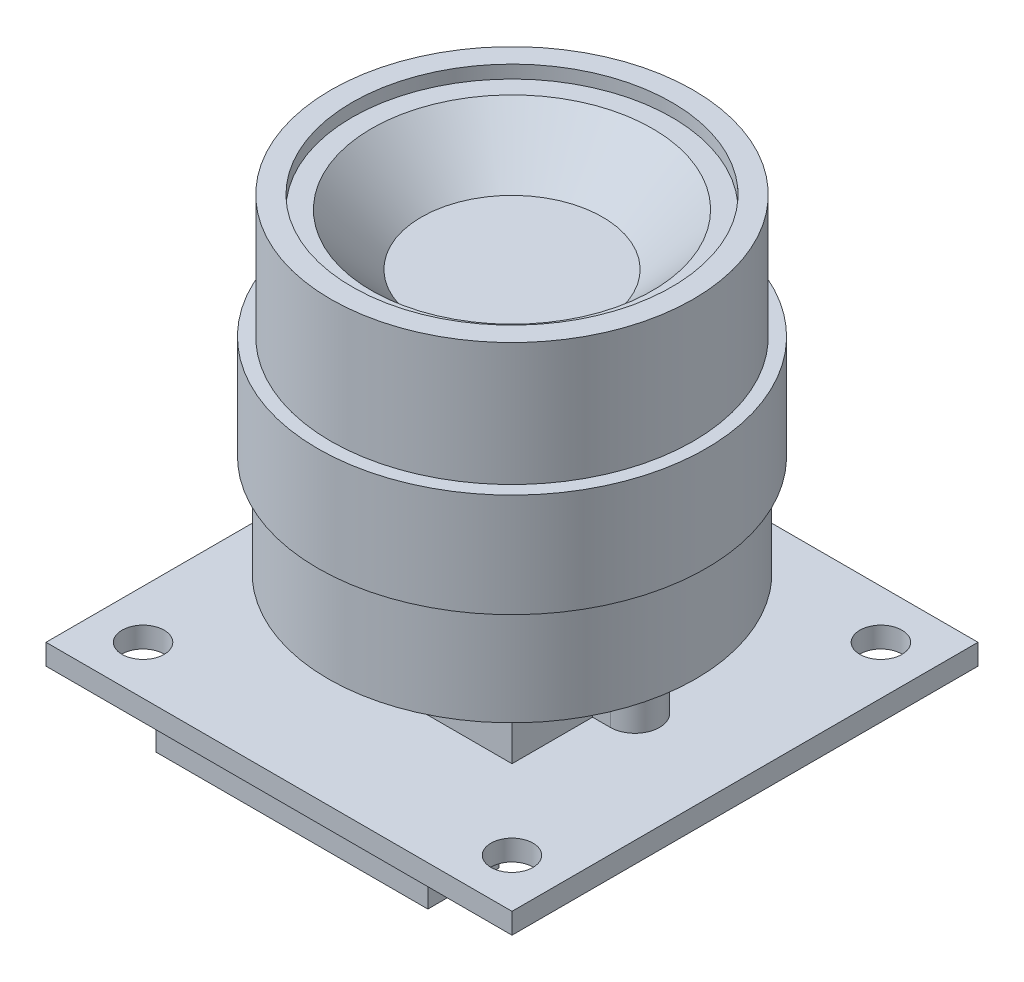
from build123d import *

# Parameters (mm, degrees)
SKETCH1_W                  = 36
SKETCH1_H                  = 36
BOSS_EXTRUDE1_DEPTH        = 1.6
F_3_2_3_2_DIAMETER_HOLE1_D = 3.25
BOSS_EXTRUDE2_DEPTH        = 4.65
SKETCH5_R                  = 14.2
BOSS_EXTRUDE3_DEPTH        = 7.8
SKETCH6_R                  = 15
BOSS_EXTRUDE4_DEPTH        = 8
SKETCH7_R                  = 14
BOSS_EXTRUDE5_DEPTH        = 9.5
SKETCH8_W                  = 21
SKETCH8_H                  = 5.5
BOSS_EXTRUDE6_DEPTH        = 2.5


with BuildPart() as part:
    # Sketch1 → Boss-Extrude1 (new body)
    with BuildSketch(Plane(origin=(0, 0, 0), x_dir=(1, 0, 0), z_dir=(0, 1, 0))):
        Rectangle(SKETCH1_W, SKETCH1_H)
    extrude(amount=BOSS_EXTRUDE1_DEPTH)

    # Ø3.2 (3.2) Diameter Hole1 (through all)
    with Locations(Plane(origin=(0, 1.6, 0), x_dir=(1, 0, 0), z_dir=(0, 1, 0))):
        with Locations((-14.25, 14.25), (14.25, 14.25), (14.25, -14.25), (-14.25, -14.25)):
            Hole(F_3_2_3_2_DIAMETER_HOLE1_D / 2)

    # Sketch4 → Boss-Extrude2 (add)
    with BuildSketch(Plane(origin=(0, 1.6, 0), x_dir=(1, 0, 0), z_dir=(0, 1, 0))):
        with BuildLine():
            Line((-8.125, -8.125), (8.125, -8.125))
            Line((8.125, -8.125), (8.125, -1.9))
            Line((8.125, -1.9), (9.5, -1.9))
            ThreePointArc((9.5, -1.9), (11.4, 0), (9.5, 1.9))
            Line((9.5, 1.9), (8.125, 1.9))
            Line((8.125, 1.9), (8.125, 8.125))
            Line((8.125, 8.125), (-8.125, 8.125))
            Line((-8.125, 8.125), (-8.125, 1.9))
            Line((-8.125, 1.9), (-9.5, 1.9))
            ThreePointArc((-9.5, 1.9), (-11.4, 0), (-9.5, -1.9))
            Line((-9.5, -1.9), (-8.125, -1.9))
            Line((-8.125, -1.9), (-8.125, -8.125))
        make_face()
    extrude(amount=BOSS_EXTRUDE2_DEPTH)

    # Sketch5 → Boss-Extrude3 (add)
    with BuildSketch(Plane(origin=(0, 6.25, 0), x_dir=(1, 0, 0), z_dir=(0, 1, 0))):
        with Locations(Location((0, 0, 0), (0, 0, 270))):
            Circle(SKETCH5_R)
    extrude(amount=BOSS_EXTRUDE3_DEPTH)

    # Sketch6 → Boss-Extrude4 (add)
    with BuildSketch(Plane(origin=(0, 14.05, 0), x_dir=(1, 0, 0), z_dir=(0, 1, 0))):
        with Locations(Location((0, 0, 0), (0, 0, 270))):
            Circle(SKETCH6_R)
    extrude(amount=BOSS_EXTRUDE4_DEPTH)

    # Sketch7 → Boss-Extrude5 (add)
    with BuildSketch(Plane(origin=(0, 22.05, 0), x_dir=(1, 0, 0), z_dir=(0, 1, 0))):
        with Locations(Location((0, 0, 0), (0, 0, 270))):
            Circle(SKETCH7_R)
    extrude(amount=BOSS_EXTRUDE5_DEPTH)

    # Sketch8 → Boss-Extrude6 (add)
    with BuildSketch(Plane.XZ):
        with Locations((0, 14.25)):
            Rectangle(SKETCH8_W, SKETCH8_H)
    extrude(amount=BOSS_EXTRUDE6_DEPTH)

    # Sketch9 → Cut-Revolve1 (revolve, cut)
    with BuildSketch(Plane.XY, mode=Mode.PRIVATE) as cut_revolve1_sk:
        Polygon((0, 31.55), (0, 26.55), (7, 26.55), (10.85, 30.55), (12.35, 30.55), (12.35, 31.55), align=None)
    revolve(cut_revolve1_sk.sketch.rotate(Axis((0, 31.55, 0), (0, -1, 0)), 180), axis=Axis((0, 31.55, 0), (0, -1, 0)), mode=Mode.SUBTRACT)


solid = part.part
